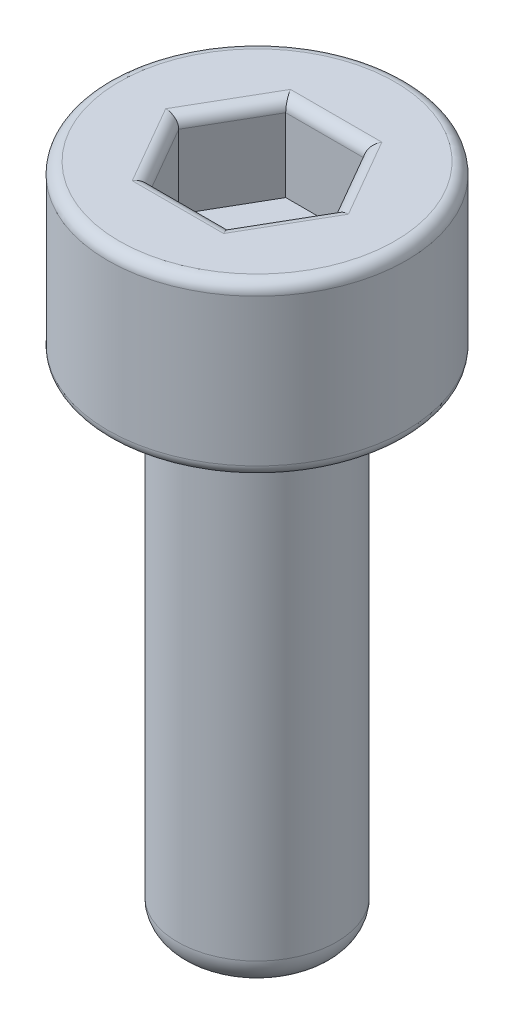
from build123d import *

# Parameters (mm, degrees)
SKETCH1_R           = 2.64
BOSS_EXTRUDE1_DEPTH = 3
SKETCH2_R           = 1.405
BOSS_EXTRUDE2_DEPTH = 8.76
FILLET1_R           = 0.2
CUT_EXTRUDE1_DEPTH  = 1.5
FILLET2_R           = 0.2
FILLET3_R           = 0.5


with BuildPart() as part:
    # Sketch1 → Boss-Extrude1 (new body)
    with BuildSketch(Plane(origin=(0, 0, 0), x_dir=(1, 0, 0), z_dir=(0, 1, 0))):
        with Locations(Location((0, 0, 0), (0, 0, 270))):
            Circle(SKETCH1_R)
    extrude(amount=BOSS_EXTRUDE1_DEPTH)

    # Sketch2 → Boss-Extrude2 (add)
    with BuildSketch(Plane.XZ):
        with Locations(Location((0, 0, 0), (0, 0, 270))):
            Circle(SKETCH2_R)
    extrude(amount=BOSS_EXTRUDE2_DEPTH)

    # Fillet1
    fillet1_edges = [part.edges().sort_by_distance(p)[0] for p in [
        (0, 0, -2.64),
        (0, 3, -2.64),
    ]]
    fillet(fillet1_edges, radius=FILLET1_R)

    # Sketch3 → Cut-Extrude1 (cut)
    with BuildSketch(Plane(origin=(0, 3, 0), x_dir=(1, 0, 0), z_dir=(0, 1, 0))):
        Polygon((1.385640646, 0), (0.692820323, 1.2), (-0.692820323, 1.2), (-1.385640646, 0), (-0.692820323, -1.2), (0.692820323, -1.2), align=None)
    extrude(amount=-CUT_EXTRUDE1_DEPTH, mode=Mode.SUBTRACT)

    # Fillet2
    fillet2_edges = [part.edges().sort_by_distance(p)[0] for p in [
        (1.039230485, 3, 0.6),
        (1.039230485, 3, -0.6),
        (0, 3, -1.2),
        (-1.039230485, 3, -0.6),
        (-1.039230485, 3, 0.6),
        (0, 3, 1.2),
    ]]
    fillet(fillet2_edges, radius=FILLET2_R)

    # Fillet3
    fillet3_edges = [part.edges().sort_by_distance(p)[0] for p in [
        (0, -8.76, 1.405),
    ]]
    fillet(fillet3_edges, radius=FILLET3_R)


solid = part.part
